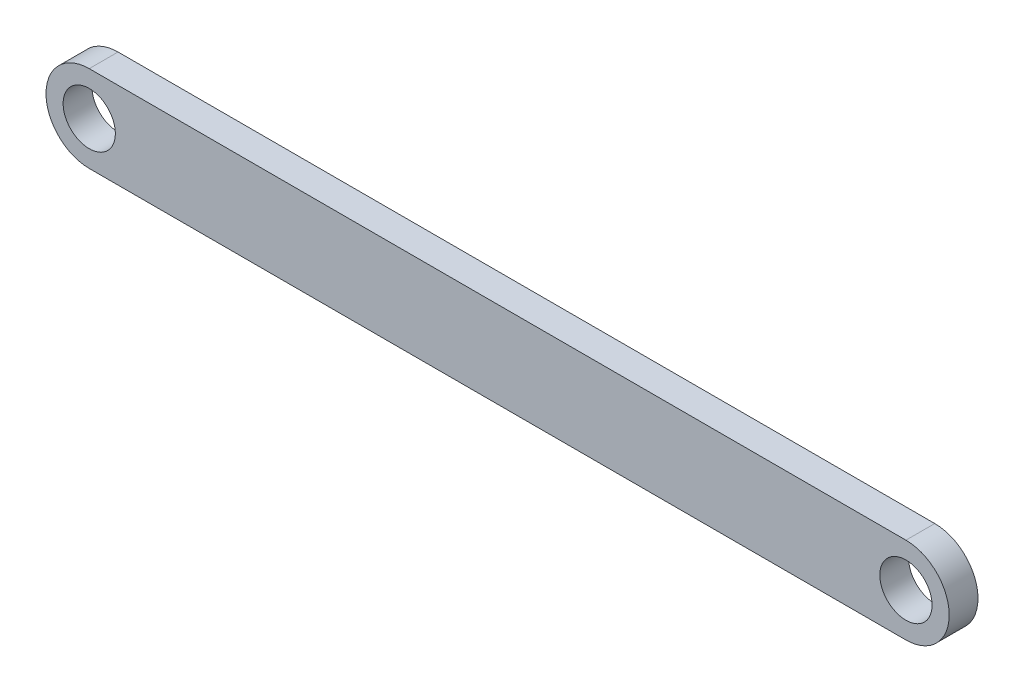
from build123d import *

# Parameters (mm, degrees)
SKETCH1_R           = 4.60375
BOSS_EXTRUDE1_DEPTH = 5.08


with BuildPart() as part:
    # Sketch1 → Boss-Extrude1 (new body)
    with BuildSketch(Plane.XY):
        with BuildLine():
            Line((0, 7.62), (143.933333333, 7.62))
            ThreePointArc((143.933333333, 7.62), (151.553333333, 0), (143.933333333, -7.62))
            Line((143.933333333, -7.62), (0, -7.62))
            ThreePointArc((0, -7.62), (-7.62, 0), (0, 7.62))
        make_face()
        Circle(SKETCH1_R, mode=Mode.SUBTRACT)
        with Locations((143.933333333, 0)):
            Circle(SKETCH1_R, mode=Mode.SUBTRACT)
    extrude(amount=BOSS_EXTRUDE1_DEPTH)


solid = part.part
